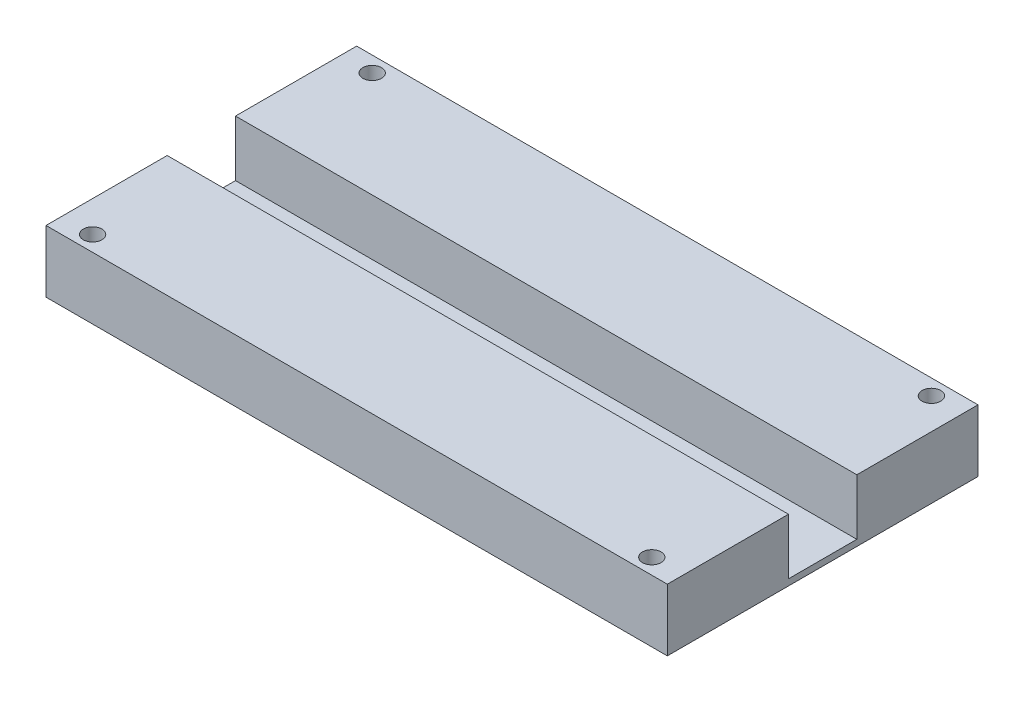
from build123d import *

# Parameters (mm, degrees)
SKETCH1_W           = 100
SKETCH1_H           = 50
SKETCH1_R           = 1.5
BOSS_EXTRUDE2_DEPTH = 10
SKETCH2_W           = 100
SKETCH2_H           = 11
CUT_EXTRUDE1_DEPTH  = 9


with BuildPart() as part:
    # Sketch1 → Boss-Extrude2 (new body)
    with BuildSketch(Plane(origin=(0, 0, 0), x_dir=(1, 0, 0), z_dir=(0, 1, 0))):
        with Locations((20, -5)):
            Rectangle(SKETCH1_W, SKETCH1_H)
        with Locations(Location((-25, 17.5, 0), (0, 0, 270))):
            Circle(SKETCH1_R, mode=Mode.SUBTRACT)
        with Locations(Location((-25, -27.5, 0), (0, 0, 270))):
            Circle(SKETCH1_R, mode=Mode.SUBTRACT)
        with Locations(Location((65, 17.5, 0), (0, 0, 270))):
            Circle(SKETCH1_R, mode=Mode.SUBTRACT)
        with Locations(Location((65, -27.5, 0), (0, 0, 270))):
            Circle(SKETCH1_R, mode=Mode.SUBTRACT)
    extrude(amount=BOSS_EXTRUDE2_DEPTH)

    # Sketch2 → Cut-Extrude1 (cut)
    with BuildSketch(Plane(origin=(0, 10, 0), x_dir=(1, 0, 0), z_dir=(0, 1, 0))):
        with Locations((20, -5)):
            Rectangle(SKETCH2_W, SKETCH2_H)
    extrude(amount=-CUT_EXTRUDE1_DEPTH, mode=Mode.SUBTRACT)


solid = part.part
